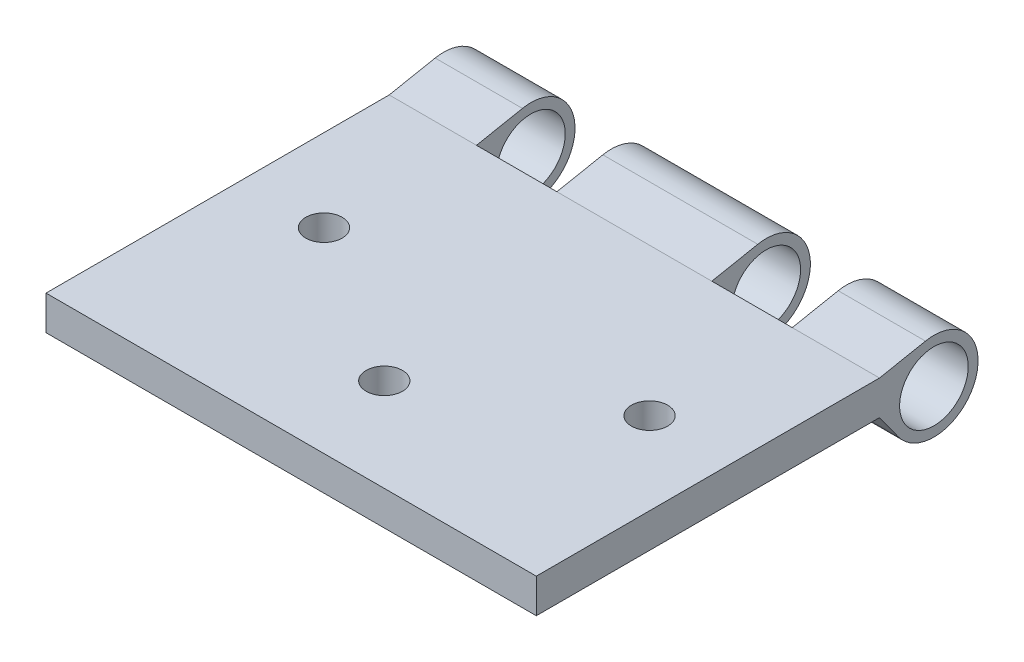
from build123d import *

# Parameters (mm, degrees)
SKETCH1_W           = 50
SKETCH1_H           = 35
BOSS_EXTRUDE1_DEPTH = 3.5
SKETCH2_R           = 1.85
CUT_EXTRUDE1_DEPTH  = 31.716445107
SKETCH3_R           = 3.5
BOSS_EXTRUDE2_DEPTH = 25
CUT_EXTRUDE2_START  = 8.2
CUT_EXTRUDE2_DEPTH  = 8.2


with BuildPart() as part:
    # Sketch1 → Boss-Extrude1 (new body)
    with BuildSketch(Plane(origin=(0, 0, 0), x_dir=(1, 0, 0), z_dir=(0, 1, 0))):
        Rectangle(SKETCH1_W, SKETCH1_H)
    extrude(amount=BOSS_EXTRUDE1_DEPTH)

    # Sketch2 → Cut-Extrude1 (cut, through all)
    with BuildSketch(Plane(origin=(0, 3.5, 0), x_dir=(1, 0, 0), z_dir=(0, 1, 0))):
        with Locations(Location((0, -8, 0), (0, 0, 270))):
            Circle(SKETCH2_R)
        with Locations(Location((16.6, 2.45, 0), (0, 0, 270))):
            Circle(SKETCH2_R)
        with Locations(Location((-16.6, 2.45, 0), (0, 0, 270))):
            Circle(SKETCH2_R)
    extrude(amount=-CUT_EXTRUDE1_DEPTH, mode=Mode.SUBTRACT)

    # Sketch3 → Boss-Extrude2 (add, symmetric)
    with BuildSketch(Plane(origin=(0, 0, 0), x_dir=(0, 0, -1), z_dir=(1, 0, 0))):
        with BuildLine():
            Line((17.5, 0), (19.401351351, -2.633887439))
            ThreePointArc((19.401351351, -2.633887439), (27.235272499, -1.653328191), (22.186446019, 4.416364401))
            Line((22.186446019, 4.416364401), (17.5, 3.5))
            Line((17.5, 3.5), (17.5, 1.655278421))
            Line((17.5, 1.655278421), (17.5, 0))
        make_face()
        with Locations((23.05, 0)):
            Circle(SKETCH3_R, mode=Mode.SUBTRACT)
    extrude(amount=BOSS_EXTRUDE2_DEPTH, both=True)

    # Sketch4 → Cut-Extrude2 (cut)
    with BuildSketch(Plane(origin=(7.9, 0, 0), x_dir=(0, 0, -1), z_dir=(1, 0, 0)).offset(CUT_EXTRUDE2_START)):
        with BuildLine():
            Line((17.5, 3.5), (17.5, 0))
            Line((17.5, 0), (19.401351351, -2.633887439))
            ThreePointArc((19.401351351, -2.633887439), (27.235272499, -1.653328191), (22.186446019, 4.416364401))
            Line((22.186446019, 4.416364401), (17.5, 3.5))
        make_face()
    cut_extrude2 = extrude(amount=-CUT_EXTRUDE2_DEPTH, mode=Mode.SUBTRACT)

    # Mirror1: Cut-Extrude2 across plane
    add(cut_extrude2.mirror(Plane(origin=(0, 0, 0), x_dir=(0, 0, 1), z_dir=(1, 0, 0))), mode=Mode.SUBTRACT)


solid = part.part
